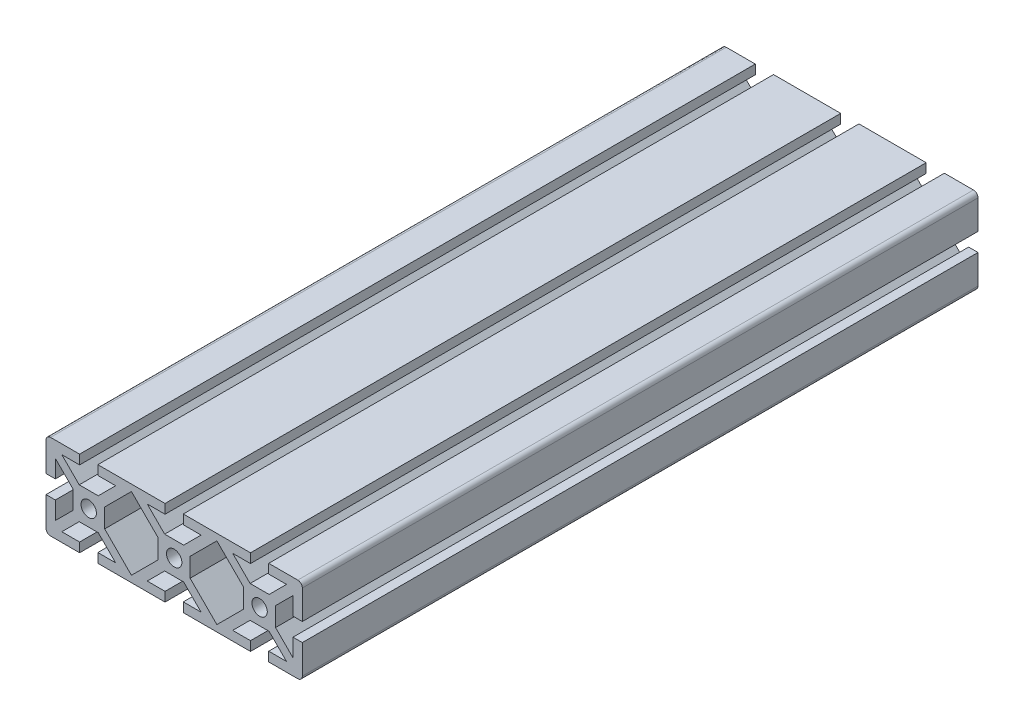
from build123d import *

# Parameters (mm, degrees)
SKETCH1_R      = 3.429
FINALCUT_DEPTH = 301.3074238


with BuildPart() as part:
    # Sketch1 → FinalCut (new body)
    with BuildSketch(Plane.XY):
        with BuildLine():
            Line((-34.036, -19.05), (-34.036, -14.8844))
            Line((-34.036, -14.8844), (-26.089281959, -14.8844))
            Line((-26.089281959, -14.8844), (-33.861681959, -7.112))
            Line((-33.861681959, -7.112), (-42.338318041, -7.112))
            Line((-42.338318041, -7.112), (-50.110718041, -14.8844))
            Line((-50.110718041, -14.8844), (-42.164, -14.8844))
            Line((-42.164, -14.8844), (-42.164, -19.05))
            Line((-42.164, -19.05), (-55.118, -19.05))
            ThreePointArc((-55.118, -19.05), (-56.554840979, -18.454840979), (-57.15, -17.018))
            Line((-57.15, -17.018), (-57.15, -4.064))
            Line((-57.15, -4.064), (-52.9844, -4.064))
            Line((-52.9844, -4.064), (-52.9844, -12.010718041))
            Line((-52.9844, -12.010718041), (-45.212, -4.238318041))
            Line((-45.212, -4.238318041), (-45.212, 4.238318041))
            Line((-45.212, 4.238318041), (-52.9844, 12.010718041))
            Line((-52.9844, 12.010718041), (-52.9844, 4.064))
            Line((-52.9844, 4.064), (-57.15, 4.064))
            Line((-57.15, 4.064), (-57.15, 17.018))
            ThreePointArc((-57.15, 17.018), (-56.554840979, 18.454840979), (-55.118, 19.05))
            Line((-55.118, 19.05), (-42.164, 19.05))
            Line((-42.164, 19.05), (-42.164, 14.8844))
            Line((-42.164, 14.8844), (-50.110718041, 14.8844))
            Line((-50.110718041, 14.8844), (-42.338318041, 7.112))
            Line((-42.338318041, 7.112), (-33.861681959, 7.112))
            Line((-33.861681959, 7.112), (-26.089281959, 14.8844))
            Line((-26.089281959, 14.8844), (-34.036, 14.8844))
            Line((-34.036, 14.8844), (-34.036, 19.05))
            Line((-34.036, 19.05), (-4.064, 19.05))
            Line((-4.064, 19.05), (-4.064, 14.8844))
            Line((-4.064, 14.8844), (-12.010718041, 14.8844))
            Line((-12.010718041, 14.8844), (-4.238318041, 7.112))
            Line((-4.238318041, 7.112), (4.238318041, 7.112))
            Line((4.238318041, 7.112), (12.010718041, 14.8844))
            Line((12.010718041, 14.8844), (4.064, 14.8844))
            Line((4.064, 14.8844), (4.064, 19.05))
            Line((4.064, 19.05), (34.036, 19.05))
            Line((34.036, 19.05), (34.036, 14.8844))
            Line((34.036, 14.8844), (26.089281959, 14.8844))
            Line((26.089281959, 14.8844), (33.861681959, 7.112))
            Line((33.861681959, 7.112), (42.338318041, 7.112))
            Line((42.338318041, 7.112), (50.110718041, 14.8844))
            Line((50.110718041, 14.8844), (42.164, 14.8844))
            Line((42.164, 14.8844), (42.164, 19.05))
            Line((42.164, 19.05), (55.118, 19.05))
            ThreePointArc((55.118, 19.05), (56.554840979, 18.454840979), (57.15, 17.018))
            Line((57.15, 17.018), (57.15, 4.064))
            Line((57.15, 4.064), (52.9844, 4.064))
            Line((52.9844, 4.064), (52.9844, 12.010718041))
            Line((52.9844, 12.010718041), (45.212, 4.238318041))
            Line((45.212, 4.238318041), (45.212, -4.238318041))
            Line((45.212, -4.238318041), (52.9844, -12.010718041))
            Line((52.9844, -12.010718041), (52.9844, -4.064))
            Line((52.9844, -4.064), (57.15, -4.064))
            Line((57.15, -4.064), (57.15, -17.018))
            ThreePointArc((57.15, -17.018), (56.554840979, -18.454840979), (55.118, -19.05))
            Line((55.118, -19.05), (42.164, -19.05))
            Line((42.164, -19.05), (42.164, -14.8844))
            Line((42.164, -14.8844), (50.110718041, -14.8844))
            Line((50.110718041, -14.8844), (42.338318041, -7.112))
            Line((42.338318041, -7.112), (33.861681959, -7.112))
            Line((33.861681959, -7.112), (26.089281959, -14.8844))
            Line((26.089281959, -14.8844), (34.036, -14.8844))
            Line((34.036, -14.8844), (34.036, -19.05))
            Line((34.036, -19.05), (4.064, -19.05))
            Line((4.064, -19.05), (4.064, -14.8844))
            Line((4.064, -14.8844), (12.010718041, -14.8844))
            Line((12.010718041, -14.8844), (4.238318041, -7.112))
            Line((4.238318041, -7.112), (-4.238318041, -7.112))
            Line((-4.238318041, -7.112), (-12.010718041, -14.8844))
            Line((-12.010718041, -14.8844), (-4.064, -14.8844))
            Line((-4.064, -14.8844), (-4.064, -19.05))
            Line((-4.064, -19.05), (-34.036, -19.05))
        make_face()
        with Locations((38.1, 0)):
            Circle(SKETCH1_R, mode=Mode.SUBTRACT)
        with Locations((-38.1, 0)):
            Circle(SKETCH1_R, mode=Mode.SUBTRACT)
        Circle(SKETCH1_R, mode=Mode.SUBTRACT)
        Polygon((-7.112, 4.238318041), (-19.05, 16.176318041), (-30.988, 4.238318041), (-30.988, -4.238318041), (-19.05, -16.176318041), (-7.112, -4.238318041), align=None, mode=Mode.SUBTRACT)
        Polygon((7.112, 4.238318041), (7.112, -4.238318041), (19.05, -16.176318041), (30.988, -4.238318041), (30.988, 4.238318041), (19.05, 16.176318041), align=None, mode=Mode.SUBTRACT)
    extrude(amount=-FINALCUT_DEPTH)


solid = part.part
